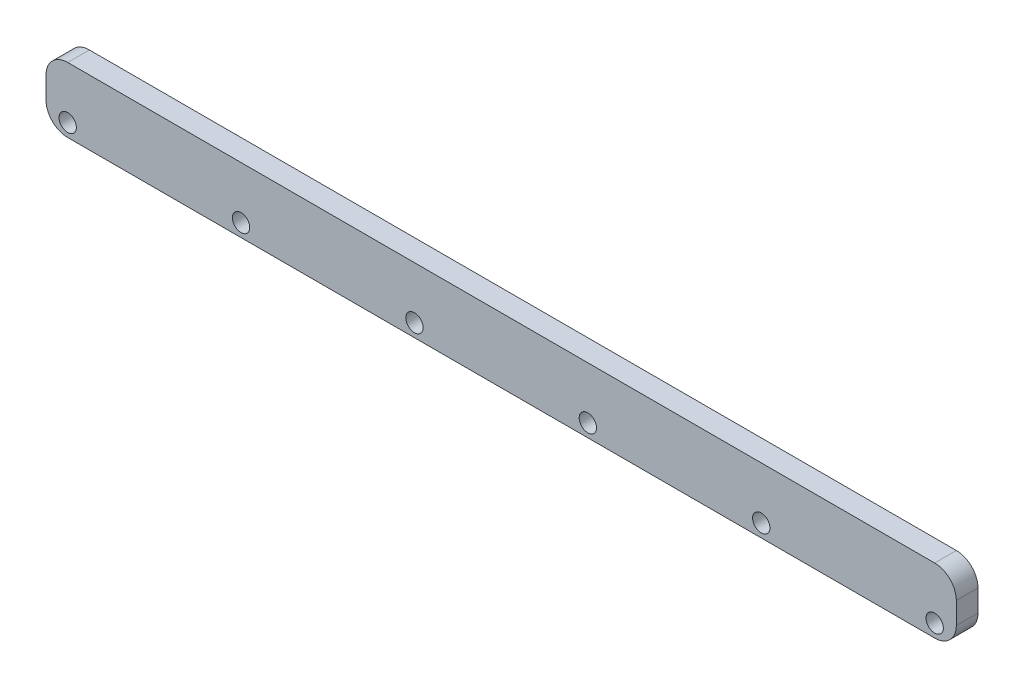
from build123d import *

# Parameters (mm, degrees)
ESQUISSE1_W        = 210
ESQUISSE1_H        = 15
ESQUISSE1_R        = 2
BOSS_EXTRU_1_DEPTH = 5
CONG_1_R           = 5


with BuildPart() as part:
    # Esquisse1 → Boss.-Extru.1 (new body)
    with BuildSketch(Plane.XY):
        with Locations((105, 7.5)):
            Rectangle(ESQUISSE1_W, ESQUISSE1_H)
        with Locations((5, 3)):
            Circle(ESQUISSE1_R, mode=Mode.SUBTRACT)
        with Locations((45, 3)):
            Circle(ESQUISSE1_R, mode=Mode.SUBTRACT)
        with Locations((85, 3)):
            Circle(ESQUISSE1_R, mode=Mode.SUBTRACT)
        with Locations((125, 3)):
            Circle(ESQUISSE1_R, mode=Mode.SUBTRACT)
        with Locations((165, 3)):
            Circle(ESQUISSE1_R, mode=Mode.SUBTRACT)
        with Locations((205, 3)):
            Circle(ESQUISSE1_R, mode=Mode.SUBTRACT)
    extrude(amount=BOSS_EXTRU_1_DEPTH)

    # Congé1
    cong_1_edges = [part.edges().sort_by_distance(p)[0] for p in [
        (0, 15, 2.5),
        (210, 15, 2.5),
        (210, 0, 2.5),
        (0, 0, 2.5),
    ]]
    fillet(cong_1_edges, radius=CONG_1_R)


solid = part.part
